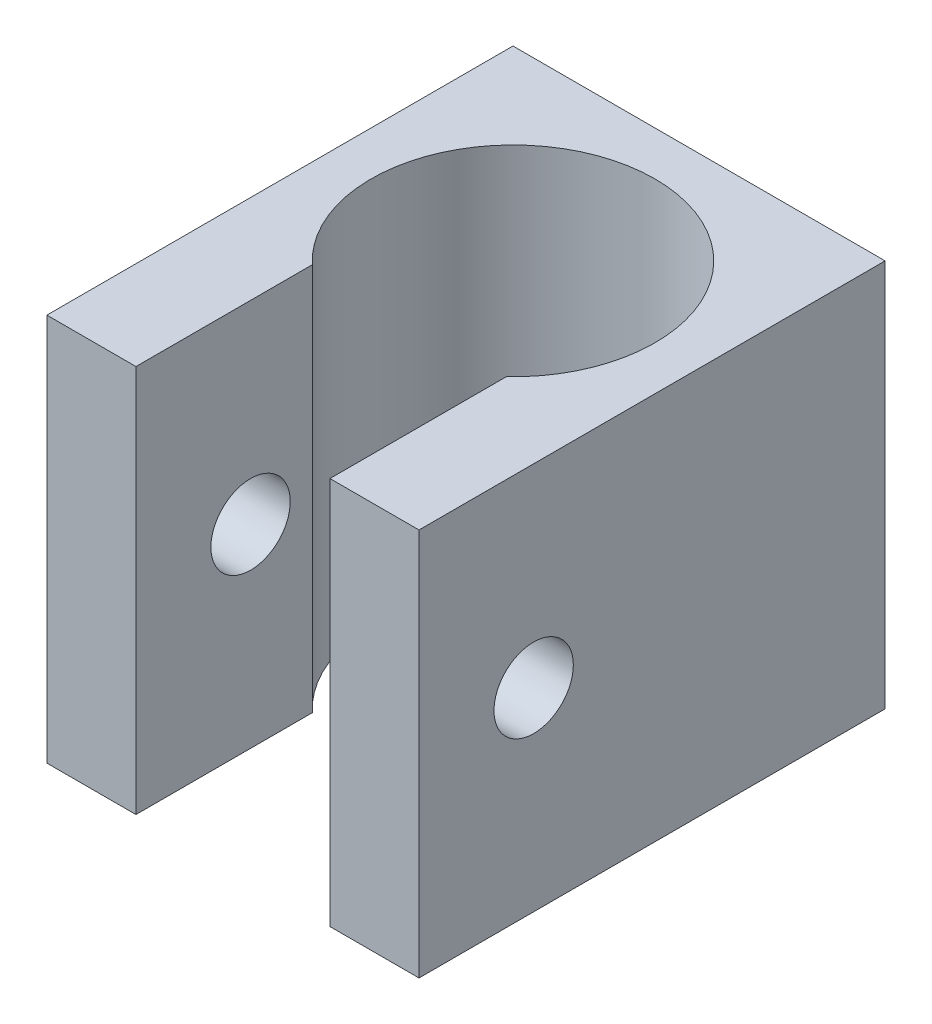
from build123d import *

# Parameters (mm, degrees)
BOSS_EXTRUDE1_DEPTH = 11
CUT_EXTRUDE1_REACH  = 30.128
SKETCH2_R           = 2.25


with BuildPart() as part:
    # Sketch1 → Boss-Extrude1 (new, symmetric)
    with BuildSketch(Plane(origin=(0, 0, 0), x_dir=(1, 0, 0), z_dir=(0, 1, 0))):
        with BuildLine():
            Line((-5.5, -15), (-10.55, -15))
            Line((-10.55, -15), (-10.55, 11.42813746))
            Line((-10.55, 11.42813746), (10.55, 11.42813746))
            Line((10.55, 11.42813746), (10.55, -15))
            Line((10.55, -15), (5.5, -15))
            Line((5.5, -15), (5.5, -5))
            ThreePointArc((5.5, -5), (0, 8.92813746), (-5.5, -5))
            Line((-5.5, -5), (-5.5, -15))
        make_face()
    extrude(amount=BOSS_EXTRUDE1_DEPTH, both=True)

    # Cut-Extrude1: up to this face of the body (flat: up to its plane)
    cut_extrude1_end = Plane(part.part.faces().sort_by_distance((-10.55, 0, 1.78593127))[0])
    # Sketch2 → Cut-Extrude1 (cut, up to the picked face)
    with BuildSketch(Plane(origin=(10.55, 0, 0), x_dir=(0, 0, -1), z_dir=(1, 0, 0)), mode=Mode.PRIVATE) as cut_extrude1_sk1:
        with Locations((-8.5, 0)):
            Circle(SKETCH2_R)
    cut_extrude1_tool1 = split(extrude(cut_extrude1_sk1.sketch, amount=-CUT_EXTRUDE1_REACH, mode=Mode.PRIVATE), bisect_by=cut_extrude1_end, keep=Keep.BOTH, mode=Mode.PRIVATE)
    add(cut_extrude1_tool1.solids().sort_by(Axis((10.55, 0, 8.5), (-1, 0, 0)))[0], mode=Mode.SUBTRACT)


solid = part.part
